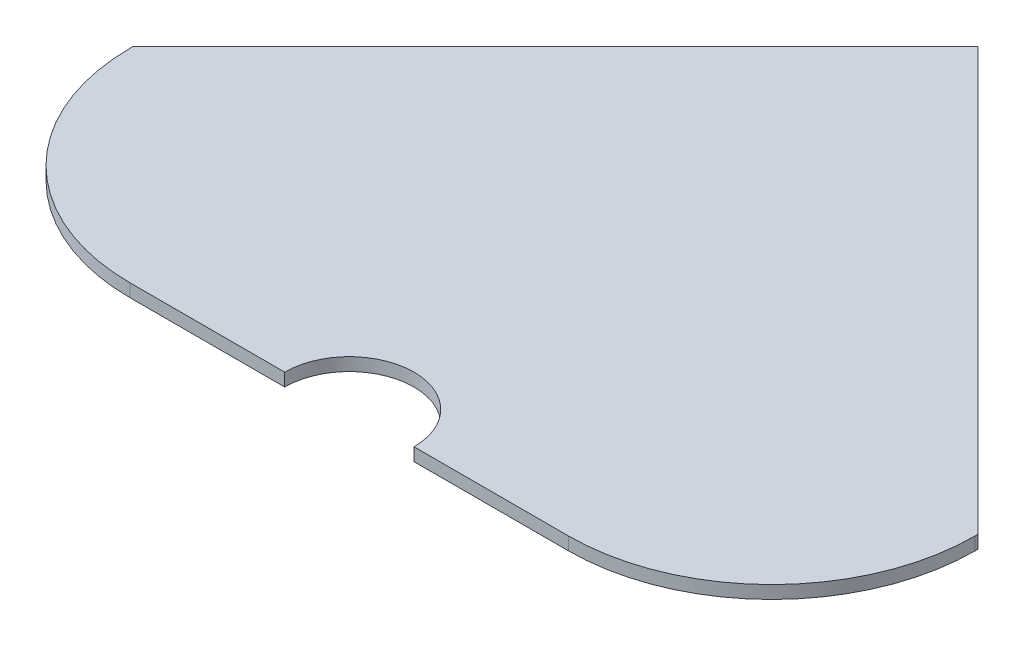
from build123d import *

# Parameters (mm, degrees)
BASIS_DEKSEL_DEPTH = 3
UITSPARING_DEPTH   = 157.456721252


with BuildPart() as part:
    # basis_deksel_schets → basis_deksel (new body)
    with BuildSketch(Plane(origin=(0, 0, 0), x_dir=(1, 0, 0), z_dir=(0, 1, 0))):
        with BuildLine():
            Line((-98, 23.925), (0, 121.925))
            Line((0, 121.925), (98, 23.925))
            Line((98, 23.925), (98, 23.225))
            ThreePointArc((98, 23.225), (84.190084733, -10.115084733), (50.85, -23.925))
            Line((50.85, -23.925), (-50.85, -23.925))
            ThreePointArc((-50.85, -23.925), (-84.190084733, -10.115084733), (-98, 23.225))
            Line((-98, 23.225), (-98, 23.925))
        make_face()
    extrude(amount=BASIS_DEKSEL_DEPTH)

    # uitsparing_schets → uitsparing (cut, through all)
    with BuildSketch(Plane(origin=(0, 3, 0), x_dir=(1, 0, 0), z_dir=(0, 1, 0))):
        with BuildLine():
            Line((-15, -23.925), (15, -23.925))
            ThreePointArc((15, -23.925), (0, -8.925), (-15, -23.925))
        make_face()
    extrude(amount=-UITSPARING_DEPTH, mode=Mode.SUBTRACT)


solid = part.part
